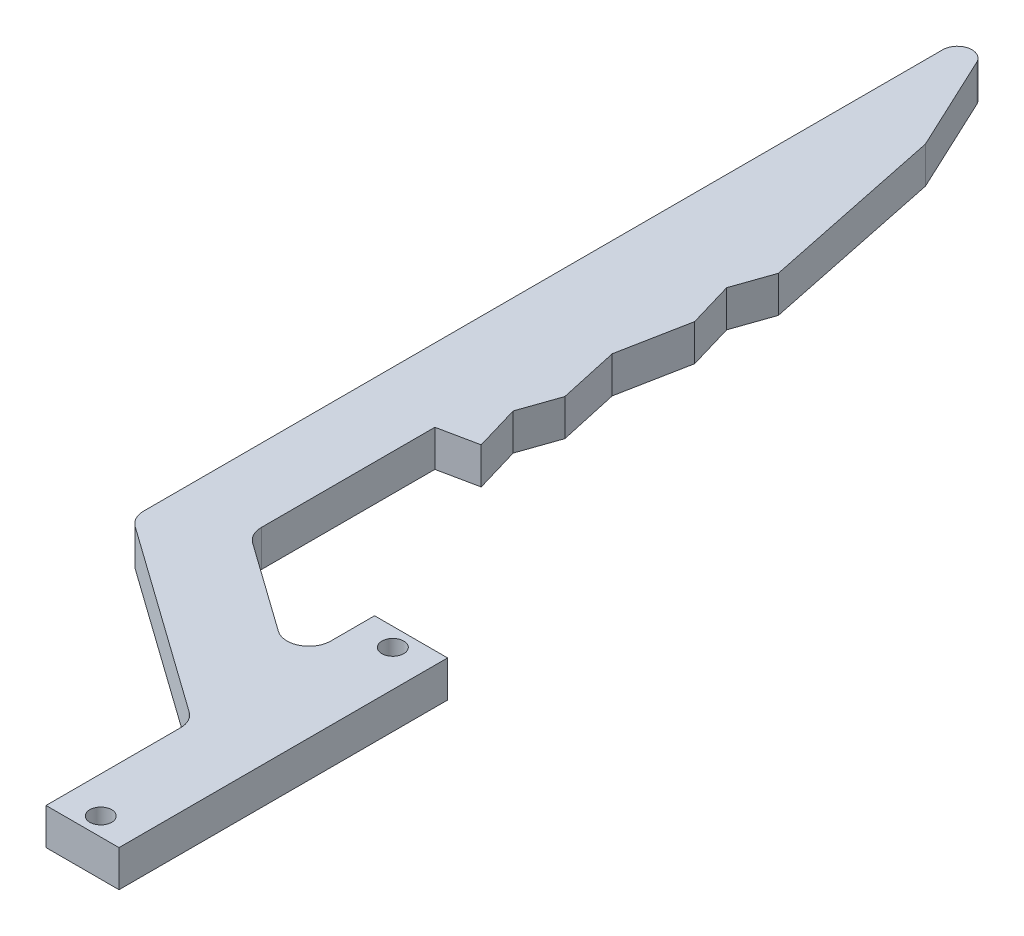
from build123d import *

# Parameters (mm, degrees)
SKETCH1_W           = 10
SKETCH1_H           = 45
BOSS_EXTRUDE1_DEPTH = 5
SKETCH2_R           = 1.5
CUT_EXTRUDE1_DEPTH  = 8
BOSS_EXTRUDE3_DEPTH = 5
BOSS_EXTRUDE4_DEPTH = 5
FILLET1_R           = 2
FILLET2_R           = 3
FILLET3_R           = 3


with BuildPart() as part:
    # Sketch1 → Boss-Extrude1 (new body)
    with BuildSketch(Plane(origin=(0, 0, 0), x_dir=(1, 0, 0), z_dir=(0, 1, 0))):
        Rectangle(SKETCH1_W, SKETCH1_H)
    extrude(amount=BOSS_EXTRUDE1_DEPTH)

    # Sketch2 → Cut-Extrude1 (cut)
    with BuildSketch(Plane(origin=(0, 5, 0), x_dir=(1, 0, 0), z_dir=(0, 1, 0))):
        with Locations(Location((0, -20, 0), (0, 0, 270))):
            Circle(SKETCH2_R)
        with Locations(Location((0, 20, 0), (0, 0, 270))):
            Circle(SKETCH2_R)
    extrude(amount=-CUT_EXTRUDE1_DEPTH, mode=Mode.SUBTRACT)

    # Sketch6 → Boss-Extrude3 (add)
    with BuildSketch(Plane(origin=(0, 5, 0), x_dir=(1, 0, 0), z_dir=(0, 1, 0))):
        Polygon((-33.227631009, 17.578800472), (-5, -2.523297008), (-5, 10.69017833), (-23.227631009, 23.670850185), (-23.227631009, 104.538936329), (-33.227631009, 104.538936329), align=None)
    extrude(amount=-BOSS_EXTRUDE3_DEPTH)

    # Sketch7 → Boss-Extrude4 (add)
    with BuildSketch(Plane(origin=(0, 5, 0), x_dir=(1, 0, 0), z_dir=(0, 1, 0))):
        Polygon((-23.227631009, 116.174137028), (-17.970128301, 90.769004099), (-19.800511719, 85.517703367), (-17.970128301, 79.310161893), (-19.800511719, 69.850883837), (-17.970128301, 61.532596279), (-19.800511719, 56.281295548), (-17.970128301, 50.073754074), (-23.227631009, 48.98573242), (-23.227631009, 104.538936329), (-33.227631009, 104.538936329), (-33.227631009, 137.531613315), align=None)
    extrude(amount=-BOSS_EXTRUDE4_DEPTH)

    # Fillet1
    fillet1_edges = [part.edges().sort_by_distance(p)[0] for p in [
        (-33.227631009, 2.5, -137.531613315),
    ]]
    fillet(fillet1_edges, radius=FILLET1_R)

    # Fillet2
    fillet2_edges = [part.edges().sort_by_distance(p)[0] for p in [
        (-5, 2.5, 2.523297008),
        (-5, 2.5, -10.69017833),
        (-23.227631009, 2.5, -23.670850185),
    ]]
    fillet(fillet2_edges, radius=FILLET2_R)

    # Fillet3
    fillet3_edges = [part.edges().sort_by_distance(p)[0] for p in [
        (-33.227631009, 2.5, -17.578800472),
    ]]
    fillet(fillet3_edges, radius=FILLET3_R)


solid = part.part
